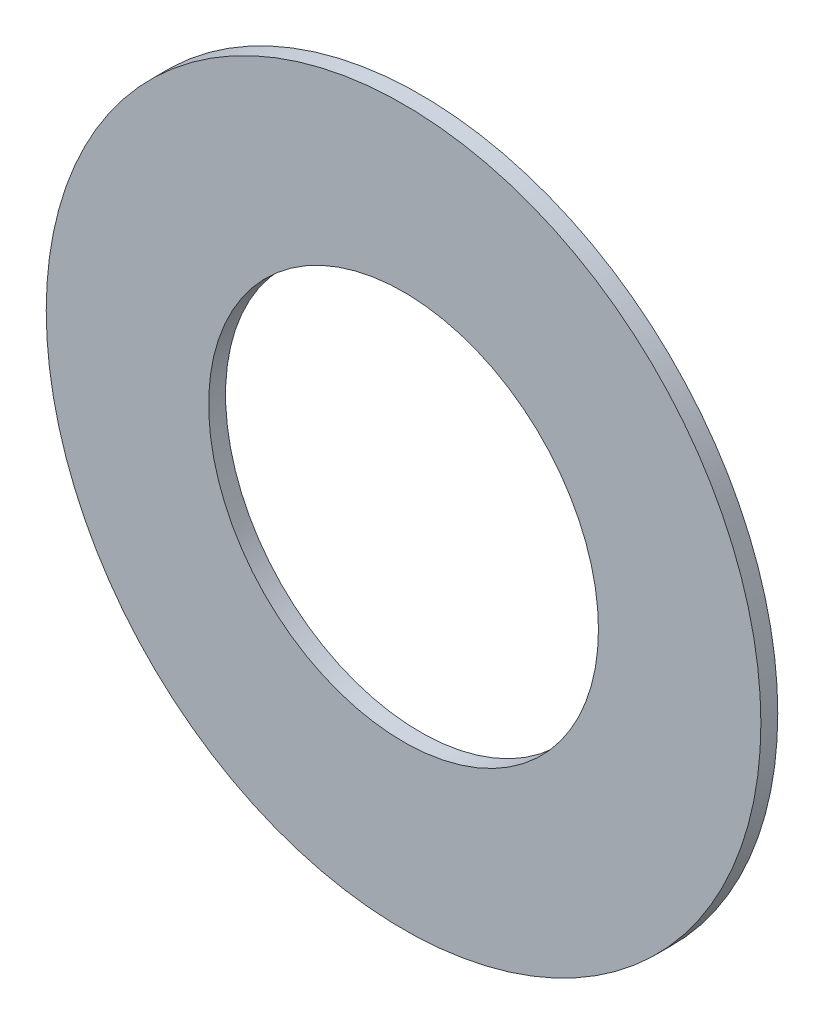
from build123d import *

# Parameters (mm, degrees)
SKETCH1_R           = 2.75
SKETCH1_R_2         = 1.5
BOSS_EXTRUDE3_DEPTH = 0.2
SKETCH2_R           = 4.835938102
CUT_EXTRUDE1_DEPTH  = 0.07


with BuildPart() as part:
    # Sketch1 → Boss-Extrude3 (new body)
    with BuildSketch(Plane.XY):
        Circle(SKETCH1_R)
        Circle(SKETCH1_R_2, mode=Mode.SUBTRACT)
    extrude(amount=BOSS_EXTRUDE3_DEPTH)

    # Sketch2 → Cut-Extrude1 (cut)
    with BuildSketch(Plane.XY.offset(0.2)):
        Circle(SKETCH2_R)
    extrude(amount=-CUT_EXTRUDE1_DEPTH, mode=Mode.SUBTRACT)


solid = part.part
